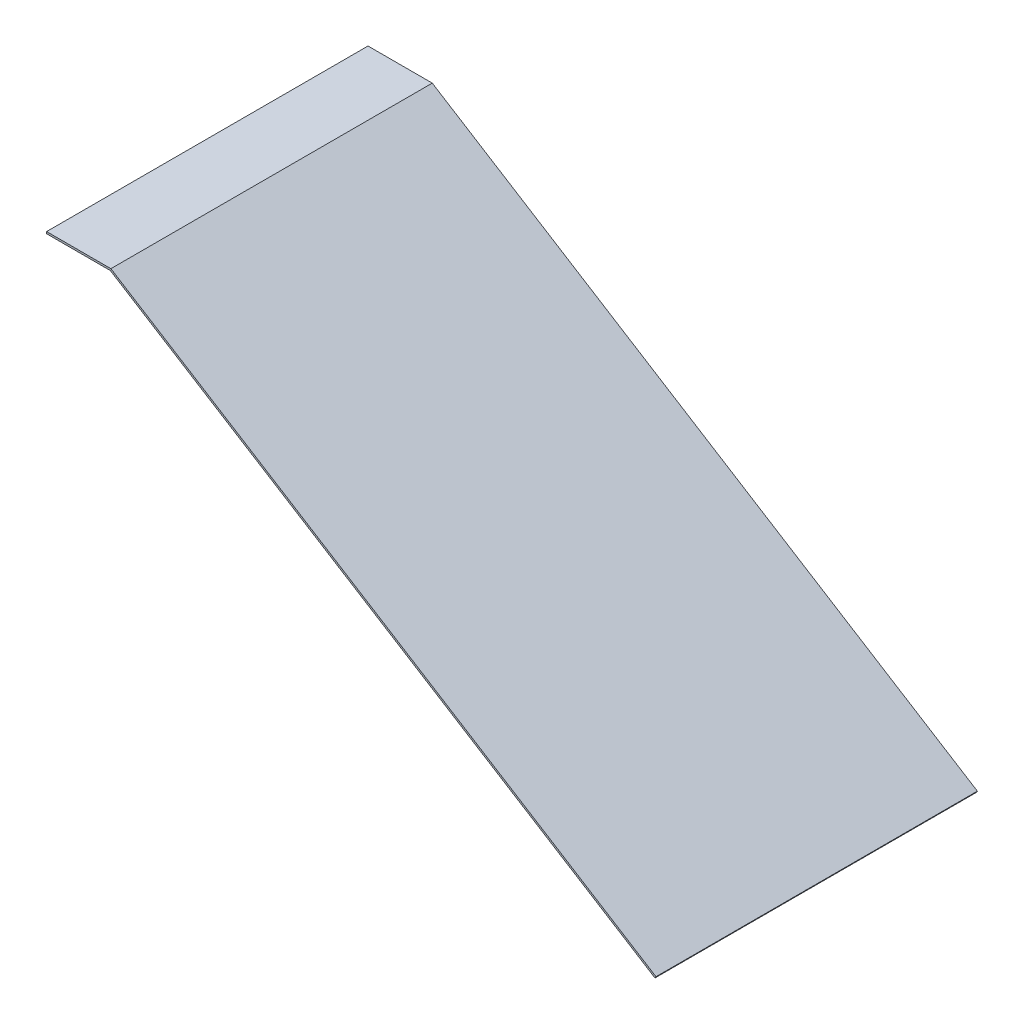
from build123d import *

# Parameters (mm, degrees)
F_304_DECK_NORMAL_T3_AND_HORIZONTAL_PLATFO_DEPTH = 500


with BuildPart() as part:
    # 草图1 → 304_deck_normal_t3_and_horizontal_platform_t3 (new body)
    with BuildSketch(Plane.XY):
        Polygon((50, 562.752128099), (150, 562.752128099), (998.048096156, 32.832863866), (996.458338364, 30.288719577), (150, 559.214592889), (150, 559.752128099), (50, 559.752128099), align=None)
    extrude(amount=F_304_DECK_NORMAL_T3_AND_HORIZONTAL_PLATFO_DEPTH)


solid = part.part
